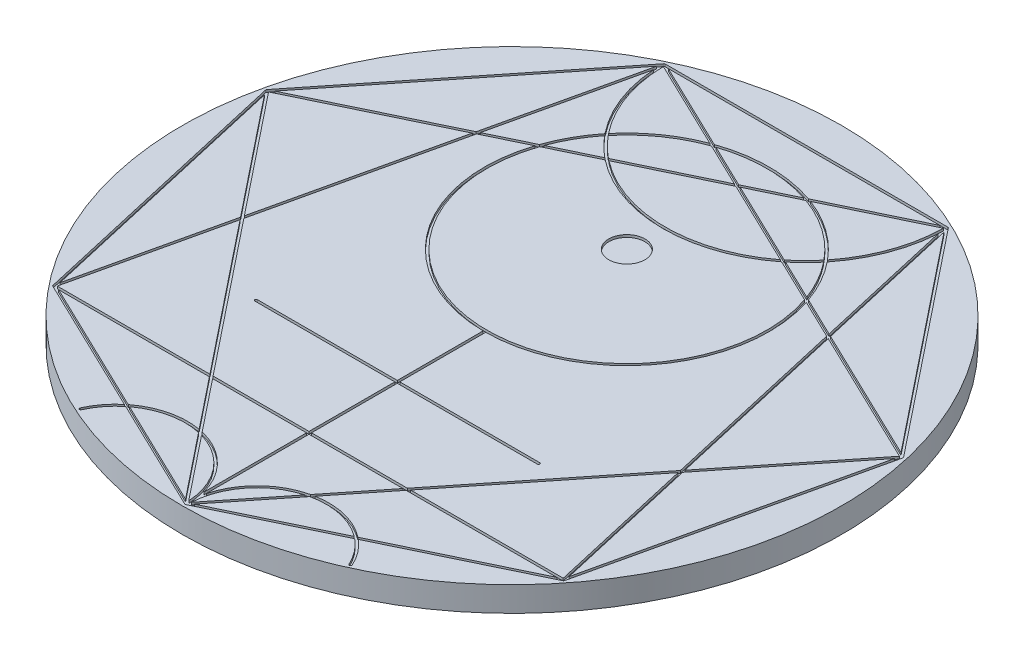
from build123d import *

# Parameters (mm, degrees)
SKETCH1_R           = 132.5
BOSS_EXTRUDE1_DEPTH = 10
SKETCH4_R           = 7.27
CUT_EXTRUDE2_DEPTH  = 1
CUT_EXTRUDE3_DEPTH  = 1


with BuildPart() as part:
    # Sketch1 → Boss-Extrude1 (new body)
    with BuildSketch(Plane(origin=(0, 0, 0), x_dir=(1, 0, 0), z_dir=(0, 1, 0))):
        with Locations(Location((0, 0, 0), (0, 0, 270))):
            Circle(SKETCH1_R)
    extrude(amount=-BOSS_EXTRUDE1_DEPTH)

    # Sketch4 → Cut-Extrude2 (cut)
    # profile 1 of 3: a face of its own
    with BuildSketch(Plane(origin=(0, 0, 0), x_dir=(1, 0, 0), z_dir=(0, 1, 0))):
        with BuildLine():
            Line((-0.5, -46.614501577), (-0.5, -123.363728943))
            ThreePointArc((-0.5, -123.363728943), (-26.039072114, -102.098724898), (-54.697575203, -118.92533484))
            ThreePointArc((-54.697575203, -118.92533484), (-54.449714233, -119.587577197), (-53.787471876, -119.339716227))
            ThreePointArc((-53.787471876, -119.339716227), (-22.483094979, -103.636494999), (-0.5, -130.9))
            ThreePointArc((-0.5, -130.9), (0, -131.4), (0.5, -130.9))
            ThreePointArc((0.5, -130.9), (22.483094979, -103.636494999), (53.787471876, -119.339716227))
            ThreePointArc((53.787471876, -119.339716227), (54.449714233, -119.587577197), (54.697575203, -118.92533484))
            ThreePointArc((54.697575203, -118.92533484), (26.039072114, -102.098724898), (0.5, -123.363728943))
            Line((0.5, -123.363728943), (0.5, -46.614501577))
            Line((0.5, -46.614501577), (56.79538145, -46.614501577))
            ThreePointArc((56.79538145, -46.614501577), (57.29538145, -46.114501577), (56.79538145, -45.614501577))
            Line((56.79538145, -45.614501577), (0.5, -45.614501577))
            Line((0.5, -45.614501577), (0.5, -11.112006373))
            ThreePointArc((0.5, -11.112006373), (51.771861801, 21.636640783), (44.671501815, 82.059009084))
            ThreePointArc((44.671501815, 82.059009084), (54.047347169, 98.919858711), (57.29538145, 117.936824808))
            ThreePointArc((57.29538145, 117.936824808), (56.79538145, 118.436824808), (56.29538145, 117.936824808))
            ThreePointArc((56.29538145, 117.936824808), (53.139078659, 99.351661589), (44.024097981, 82.850520221))
            ThreePointArc((44.024097981, 82.850520221), (0, 103.47657481), (-44.024097981, 82.850520221))
            ThreePointArc((-44.024097981, 82.850520221), (-53.139078659, 99.351661589), (-56.29538145, 117.936824808))
            ThreePointArc((-56.29538145, 117.936824808), (-56.79538145, 118.436824808), (-57.29538145, 117.936824808))
            ThreePointArc((-57.29538145, 117.936824808), (-54.047347169, 98.919858711), (-44.671501815, 82.059009084))
            ThreePointArc((-44.671501815, 82.059009084), (-51.771861801, 21.636640783), (-0.5, -11.112006373))
            Line((-0.5, -11.112006373), (-0.5, -45.614501577))
            Line((-0.5, -45.614501577), (-56.79538145, -45.614501577))
            ThreePointArc((-56.79538145, -45.614501577), (-57.29538145, -46.114501577), (-56.79538145, -46.614501577))
            Line((-56.79538145, -46.614501577), (-0.5, -46.614501577))
        make_face()
        with BuildLine():
            ThreePointArc((56.29538145, 46.18119336), (-18.585163219, -6.9578853), (-44.024097981, 81.267497947))
            ThreePointArc((-44.024097981, 81.267497947), (-43.704578003, 81.664708324), (-43.381474289, 82.059009084))
            ThreePointArc((-43.381474289, 82.059009084), (0, 102.47657481), (43.381474289, 82.059009084))
            ThreePointArc((43.381474289, 82.059009084), (43.704578003, 81.664708324), (44.024097981, 81.267497947))
            ThreePointArc((44.024097981, 81.267497947), (53.139078659, 64.766356579), (56.29538145, 46.18119336))
        make_face(mode=Mode.SUBTRACT)
    # profile 2 of 3: a face of its own
    with BuildSketch(Plane(origin=(0, 0, 0), x_dir=(1, 0, 0), z_dir=(0, 1, 0))):
        with BuildLine():
            ThreePointArc((-43.381474289, 82.059009084), (-43.704578003, 81.664708324), (-44.024097981, 81.267497947))
            ThreePointArc((-44.024097981, 81.267497947), (0, 60.641443358), (44.024097981, 81.267497947))
            ThreePointArc((44.024097981, 81.267497947), (43.704578003, 81.664708324), (43.381474289, 82.059009084))
            ThreePointArc((43.381474289, 82.059009084), (0, 61.641443358), (-43.381474289, 82.059009084))
        make_face()
    # profile 3 of 3: a face of its own
    with BuildSketch(Plane(origin=(0, 0, 0), x_dir=(1, 0, 0), z_dir=(0, 1, 0))):
        with Locations(Location((0, 46.18119336, 0), (0, 0, 270))):
            Circle(SKETCH4_R)
    extrude(amount=-CUT_EXTRUDE2_DEPTH, mode=Mode.SUBTRACT)

    # Sketch5 → Cut-Extrude3 (cut)
    # profile 1 of 8: a face of its own
    with BuildSketch(Plane(origin=(0, 0, 0), x_dir=(1, 0, 0), z_dir=(0, 1, 0))):
        with BuildLine():
            ThreePointArc((0.5, -130.9), (0.4233621, -131.166016038), (0.21694187, -131.350484434))
            Line((0.21694187, -131.350484434), (46.035485479, -109.285436761))
            ThreePointArc((46.035485479, -109.285436761), (45.600159712, -108.937390671), (45.157967719, -108.598110778))
            Line((45.157967719, -108.598110778), (1.756759395, -129.499031132))
            Line((1.756759395, -129.499031132), (22.359897198, -103.663513495))
            ThreePointArc((22.359897198, -103.663513495), (21.555744487, -103.854317914), (20.757596694, -104.068859305))
            Line((20.757596694, -104.068859305), (0.539181887, -129.421949563))
            ThreePointArc((0.539181887, -129.421949563), (0.523291896, -129.760246656), (0.511509831, -130.098711716))
            ThreePointArc((0.511509831, -130.098711716), (0.502877606, -130.499314528), (0.5, -130.9))
        make_face()
    # profile 2 of 8: a face of its own
    with BuildSketch(Plane(origin=(0, 0, 0), x_dir=(1, 0, 0), z_dir=(0, 1, 0))):
        with BuildLine():
            Line((-46.035485479, -109.285436761), (-0.21694187, -131.350484434))
            ThreePointArc((-0.21694187, -131.350484434), (-0.4233621, -131.166016038), (-0.5, -130.9))
            ThreePointArc((-0.5, -130.9), (-0.509797192, -130.160715157), (-0.539181887, -129.421949562))
            Line((-0.539181887, -129.421949562), (-20.757596693, -104.068859305))
            ThreePointArc((-20.757596693, -104.068859305), (-21.555744486, -103.854317915), (-22.359897197, -103.663513495))
            Line((-22.359897197, -103.663513495), (-1.756759395, -129.499031131))
            Line((-1.756759395, -129.499031131), (-45.157967718, -108.598110777))
            ThreePointArc((-45.157967718, -108.598110777), (-45.600159712, -108.93739067), (-46.035485479, -109.285436761))
        make_face()
    # profile 3 of 8: a face of its own
    with BuildSketch(Plane(origin=(0, 0, 0), x_dir=(1, 0, 0), z_dir=(0, 1, 0))):
        with BuildLine():
            ThreePointArc((46.167760692, -108.111820112), (46.600425974, -108.455914839), (47.026429874, -108.808223092))
            Line((47.026429874, -108.808223092), (102.558682925, -82.065299497))
            ThreePointArc((102.558682925, -82.065299497), (102.732656796, -81.926559964), (102.829205011, -81.72607553))
            Line((102.829205011, -81.72607553), (128.105527661, 29.016729788))
            ThreePointArc((128.105527661, 29.016729788), (128.105527661, 29.239250722), (128.008979446, 29.439735156))
            Line((128.008979446, 29.439735156), (57.186297192, 118.248569709))
            ThreePointArc((57.186297192, 118.248569709), (57.267323116, 118.101964339), (57.29538145, 117.936824808))
            ThreePointArc((57.29538145, 117.936824808), (57.262733912, 116.002906394), (57.164828504, 114.071191915))
            Line((57.164828504, 114.071191915), (70.104183615, 57.380173272))
            Line((70.104183615, 57.380173272), (54.083403044, 65.095374568))
            ThreePointArc((54.083403044, 65.095374568), (54.309978412, 64.434603464), (54.528481058, 63.771119143))
            Line((54.528481058, 63.771119143), (70.388798746, 56.133192914))
            Line((70.388798746, 56.133192914), (87.773396172, -20.033704763))
            Line((87.773396172, -20.033704763), (39.062836749, -81.114814305))
            Line((39.062836749, -81.114814305), (0.5, -81.114814304))
            Line((0.5, -81.114814304), (0.5, -82.114815063))
            Line((0.5, -82.114815063), (38.265362755, -82.114815063))
            Line((38.265362755, -82.114815063), (21.796244886, -102.766435667))
            ThreePointArc((21.796244886, -102.766435667), (22.559551582, -102.598186267), (23.327129481, -102.450642574))
            Line((23.327129481, -102.450642574), (39.544410763, -82.114815063))
            Line((39.544410763, -82.114815063), (100.151097921, -82.114815064))
            Line((100.151097921, -82.114815064), (46.167760692, -108.111820112))
        make_face()
        Polygon((88.05801113, -21.280684366), (101.714760886, -81.114814305), (40.341884756, -81.114814305), align=None, mode=Mode.SUBTRACT)
        Polygon((126.643135792, 27.103531585), (102.341741055, -79.36783546), (88.855484425, -20.280684484), align=None, mode=Mode.SUBTRACT)
        Polygon((71.541181117, 55.578234829), (126.836232281, 28.949542394), (88.570869467, -19.03370488), align=None, mode=Mode.SUBTRACT)
        Polygon((57.770309363, 115.912366139), (125.861304301, 30.528959133), (71.256565992, 56.825215168), align=None, mode=Mode.SUBTRACT)
    # profile 4 of 8: a face of its own
    with BuildSketch(Plane(origin=(0, 0, 0), x_dir=(1, 0, 0), z_dir=(0, 1, 0))):
        with BuildLine():
            Line((-102.558682925, -82.065299497), (-47.026429874, -108.808223092))
            ThreePointArc((-47.026429874, -108.808223092), (-46.600425974, -108.455914839), (-46.167760691, -108.111820111))
            Line((-46.167760691, -108.111820111), (-100.151097921, -82.114815062))
            Line((-100.151097921, -82.114815062), (-39.544410763, -82.114815062))
            Line((-39.544410763, -82.114815062), (-23.327129481, -102.450642575))
            ThreePointArc((-23.327129481, -102.450642575), (-22.559551581, -102.598186267), (-21.796244885, -102.766435667))
            Line((-21.796244885, -102.766435667), (-38.265362755, -82.114815062))
            Line((-38.265362755, -82.114815062), (-0.5, -82.114815063))
            Line((-0.5, -82.114815063), (-0.5, -81.114814304))
            Line((-0.5, -81.114814304), (-39.062836749, -81.114814304))
            Line((-39.062836749, -81.114814304), (-87.773395956, -20.033705033))
            Line((-87.773395956, -20.033705033), (-70.388799193, 56.133193365))
            Line((-70.388799193, 56.133193365), (-54.528480721, 63.771120189))
            ThreePointArc((-54.528480721, 63.771120189), (-54.309978238, 64.434603982), (-54.083403045, 65.095374563))
            Line((-54.083403045, 65.095374563), (-70.10418425, 57.380172961))
            Line((-70.10418425, 57.380172961), (-57.164828774, 114.071195902))
            ThreePointArc((-57.164828774, 114.071195902), (-57.26273398, 116.002908391), (-57.29538145, 117.936824808))
            ThreePointArc((-57.29538145, 117.936824808), (-57.267323116, 118.101964339), (-57.186297192, 118.248569709))
            Line((-57.186297192, 118.248569709), (-128.008979446, 29.439735156))
            ThreePointArc((-128.008979446, 29.439735156), (-128.105527661, 29.239250722), (-128.105527661, 29.016729788))
            Line((-128.105527661, 29.016729788), (-102.829205011, -81.72607553))
            ThreePointArc((-102.829205011, -81.72607553), (-102.732656796, -81.926559964), (-102.558682925, -82.065299497))
        make_face()
        Polygon((-40.341884757, -81.114814304), (-101.714759945, -81.114814303), (-88.058010903, -21.280684649), align=None, mode=Mode.SUBTRACT)
        Polygon((-102.341741455, -79.367833707), (-126.643135792, 27.103531586), (-88.855485508, -20.280683124), align=None, mode=Mode.SUBTRACT)
        Polygon((-88.57087056, -19.033703508), (-126.836232219, 28.949542318), (-71.541183372, 55.578234393), align=None, mode=Mode.SUBTRACT)
        Polygon((-125.861304387, 30.528959085), (-57.770311988, 115.912366734), (-71.256568429, 56.82521399), align=None, mode=Mode.SUBTRACT)
    # profile 5 of 8: a face of its own
    with BuildSketch(Plane(origin=(0, 0, 0), x_dir=(1, 0, 0), z_dir=(0, 1, 0))):
        with BuildLine():
            ThreePointArc((56.29538145, 117.936824808), (56.44182806, 118.290378199), (56.79538145, 118.436824808))
            Line((56.79538145, 118.436824808), (-56.79538145, 118.436824808))
            ThreePointArc((-56.79538145, 118.436824808), (-56.44182806, 118.290378199), (-56.29538145, 117.936824808))
            ThreePointArc((-56.29538145, 117.936824808), (-56.293965699, 117.53757729), (-56.289718514, 117.138349853))
            Line((-56.289718514, 117.138349853), (-20.245595281, 99.780415437))
            ThreePointArc((-20.245595281, 99.780415437), (-19.590627593, 100.023259127), (-18.932747917, 100.258099631))
            Line((-18.932747917, 100.258099631), (-54.604738317, 117.436824808))
            Line((-54.604738317, 117.436824808), (54.604738317, 117.436824808))
            Line((54.604738317, 117.436824808), (18.932747919, 100.25809963))
            ThreePointArc((18.932747919, 100.25809963), (19.59062648, 100.023259532), (20.245593063, 99.780416274))
            Line((20.245593063, 99.780416274), (56.289718548, 117.138352268))
            ThreePointArc((56.289718548, 117.138352268), (56.293965707, 117.537578498), (56.29538145, 117.936824808))
        make_face()
    # profile 6 of 8: a face of its own
    with BuildSketch(Plane(origin=(0, 0, 0), x_dir=(1, 0, 0), z_dir=(0, 1, 0))):
        with BuildLine():
            Line((1.152382431, 90.585610641), (18.991419399, 99.17643807))
            ThreePointArc((18.991419399, 99.17643807), (18.320815411, 99.411989853), (17.64729092, 99.639056166))
            Line((17.64729092, 99.639056166), (2e-09, 91.140568769))
            Line((2e-09, 91.140568769), (-17.647290918, 99.639056167))
            ThreePointArc((-17.647290918, 99.639056167), (-18.320816539, 99.411989465), (-18.991421647, 99.176437264))
            Line((-18.991421647, 99.176437264), (-1.152384136, 90.585609817))
            Line((-1.152384136, 90.585609817), (-35.344350552, 74.119626624))
            ThreePointArc((-35.344350552, 74.119626624), (-34.909775908, 73.772613973), (-34.471794488, 73.429911217))
            Line((-34.471794488, 73.429911217), (-1.691e-06, 90.030651696))
            Line((-1.691e-06, 90.030651696), (34.471793567, 73.429910504))
            ThreePointArc((34.471793567, 73.429910504), (34.909775452, 73.772613612), (35.344350555, 74.119626626))
            Line((35.344350555, 74.119626626), (1.152382431, 90.585610641))
        make_face()
    # profile 7 of 8: a face of its own
    with BuildSketch(Plane(origin=(0, 0, 0), x_dir=(1, 0, 0), z_dir=(0, 1, 0))):
        with BuildLine():
            ThreePointArc((53.274307424, 64.375097316), (53.040354297, 65.046261308), (52.797946045, 65.714418032))
            Line((52.797946045, 65.714418032), (36.339735415, 73.640274542))
            ThreePointArc((36.339735415, 73.640274542), (35.909841923, 73.291063659), (35.476592847, 72.946024687))
            Line((35.476592847, 72.946024687), (53.274307424, 64.375097316))
        make_face()
    # profile 8 of 8: a face of its own
    with BuildSketch(Plane(origin=(0, 0, 0), x_dir=(1, 0, 0), z_dir=(0, 1, 0))):
        with BuildLine():
            Line((-36.339735412, 73.64027454), (-52.797946047, 65.714418027))
            ThreePointArc((-52.797946047, 65.714418027), (-53.040354107, 65.046261842), (-53.274307056, 64.375098394))
            Line((-53.274307056, 64.375098394), (-35.476593747, 72.946025397))
            ThreePointArc((-35.476593747, 72.946025397), (-35.909842369, 73.291064018), (-36.339735412, 73.64027454))
        make_face()
    extrude(amount=-CUT_EXTRUDE3_DEPTH, mode=Mode.SUBTRACT)


solid = part.part
